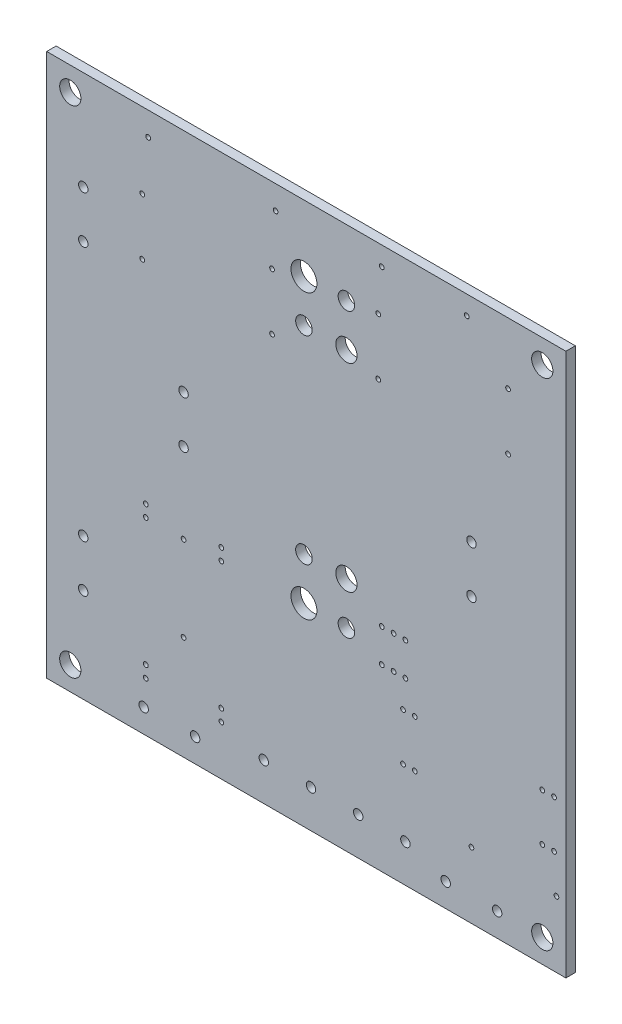
from build123d import *

# Parameters (mm, degrees)
SKETCH_1_W          = 110
SKETCH_1_H          = 115
SKETCH_1_R          = 2.25
EXTRUDE_1_DEPTH     = 2
SKETCH_2_R          = 1
SKETCH_2_R_2        = 0.5
CUT_EXTRUDE_1_DEPTH = 2
SKETCH_3_R          = 1
SKETCH_3_R_2        = 1.75
SKETCH_3_R_3        = 2.75
SKETCH_3_R_4        = 2.25
SKETCH_3_R_5        = 0.5
CUT_EXTRUDE_2_DEPTH = 2
SKETCH_4_R          = 0.5
CUT_EXTRUDE_3_DEPTH = 10


with BuildPart() as part:
    # Эскиз1 → Вытянуть1 (new body)
    with BuildSketch(Plane.XY):
        Rectangle(SKETCH_1_W, SKETCH_1_H)
        with Locations((-50, 52.5)):
            Circle(SKETCH_1_R, mode=Mode.SUBTRACT)
        with Locations(Location((50, 52.5, 0), (0, 0, 180))):
            Circle(SKETCH_1_R, mode=Mode.SUBTRACT)
        with Locations((50, -52.5)):
            Circle(SKETCH_1_R, mode=Mode.SUBTRACT)
        with Locations(Location((-50, -52.5, 0), (0, 0, 180))):
            Circle(SKETCH_1_R, mode=Mode.SUBTRACT)
    extrude(amount=EXTRUDE_1_DEPTH)

    # Эскиз2 → Вырез-Вытянуть1 (cut)
    with BuildSketch(Plane.XY.offset(2)):
        with Locations((-47.25, -37.5)):
            Circle(SKETCH_2_R)
        with Locations((-47.25, -27.5)):
            Circle(SKETCH_2_R)
        with Locations((-47.25, 26.5)):
            Circle(SKETCH_2_R)
        with Locations((-47.25, 36.5)):
            Circle(SKETCH_2_R)
        with Locations((29.55, -52.5)):
            Circle(SKETCH_2_R)
        with Locations((40.45, -52.5)):
            Circle(SKETCH_2_R)
        with Locations((-34.45, -52.5)):
            Circle(SKETCH_2_R)
        with Locations((-23.55, -52.5)):
            Circle(SKETCH_2_R)
        with Locations((-34, -44.5)):
            Circle(SKETCH_2_R_2)
        with Locations((-34, -17.5)):
            Circle(SKETCH_2_R_2)
        with Locations((-18, -44.5)):
            Circle(SKETCH_2_R_2)
        with Locations((-18, -17.5)):
            Circle(SKETCH_2_R_2)
        with Locations((-34, -47)):
            Circle(SKETCH_2_R_2)
        with Locations((-9, -49.5)):
            Circle(SKETCH_2_R)
        with Locations((1, -49.5)):
            Circle(SKETCH_2_R)
        with Locations((11, -49.5)):
            Circle(SKETCH_2_R)
        with Locations((21, -49.5)):
            Circle(SKETCH_2_R)
        with Locations((-34, -15)):
            Circle(SKETCH_2_R_2)
        with Locations((-18, -15)):
            Circle(SKETCH_2_R_2)
        with Locations((-18, -47)):
            Circle(SKETCH_2_R_2)
        with Locations((23, -35.5)):
            Circle(SKETCH_2_R_2)
        with Locations((50, -35.5)):
            Circle(SKETCH_2_R_2)
        with Locations((20.5, -35.5)):
            Circle(SKETCH_2_R_2)
        with Locations((52.5, -35.5)):
            Circle(SKETCH_2_R_2)
        with Locations((23, -25.5)):
            Circle(SKETCH_2_R_2)
        with Locations((50, -25.5)):
            Circle(SKETCH_2_R_2)
        with Locations((20.5, -25.5)):
            Circle(SKETCH_2_R_2)
        with Locations((52.5, -25.5)):
            Circle(SKETCH_2_R_2)
        with Locations((-33.5, 52.5)):
            Circle(SKETCH_2_R_2)
        with Locations((-6.5, 52.5)):
            Circle(SKETCH_2_R_2)
    extrude(amount=-CUT_EXTRUDE_1_DEPTH, mode=Mode.SUBTRACT)

    # Эскиз3 → Вырез-Вытянуть2 (cut)
    with BuildSketch(Plane.XY.offset(2)):
        with Locations((-26, 9.5)):
            Circle(SKETCH_3_R)
        with Locations((-26, -0.5)):
            Circle(SKETCH_3_R)
        with Locations((-0.5, 34.5)):
            Circle(SKETCH_3_R_2)
        with Locations((-0.5, 43.5)):
            Circle(SKETCH_3_R_3)
        with Locations((8.5, 43.5)):
            Circle(SKETCH_3_R_2)
        with Locations((8.5, 34.5)):
            Circle(SKETCH_3_R_4)
        with Locations(Location((8.5, -16.5, 0), (0, 0, 180))):
            Circle(SKETCH_3_R_2)
        with Locations(Location((8.5, -7.5, 0), (0, 0, 180))):
            Circle(SKETCH_3_R_4)
        with Locations(Location((-0.5, -16.5, 0), (0, 0, 180))):
            Circle(SKETCH_3_R_3)
        with Locations(Location((-0.5, -7.5, 0), (0, 0, 180))):
            Circle(SKETCH_3_R_2)
        with Locations((35, 12.5)):
            Circle(SKETCH_3_R)
        with Locations((35, 2.5)):
            Circle(SKETCH_3_R)
        with Locations((21, -19.5)):
            Circle(SKETCH_3_R_5)
        with Locations((18.5, -19.5)):
            Circle(SKETCH_3_R_5)
        with Locations((16, -19.5)):
            Circle(SKETCH_3_R_5)
        with Locations((21, -12.5)):
            Circle(SKETCH_3_R_5)
        with Locations((18.5, -12.5)):
            Circle(SKETCH_3_R_5)
        with Locations((16, -12.5)):
            Circle(SKETCH_3_R_5)
        with Locations((-26, -35.5)):
            Circle(SKETCH_3_R_5)
        with Locations((-26, -17.5)):
            Circle(SKETCH_3_R_5)
        with Locations((35, -43.5)):
            Circle(SKETCH_3_R_5)
        with Locations((53, -43.5)):
            Circle(SKETCH_3_R_5)
        with Locations((16, 53.5)):
            Circle(SKETCH_3_R_5)
        with Locations((34, 53.5)):
            Circle(SKETCH_3_R_5)
    extrude(amount=-CUT_EXTRUDE_2_DEPTH, mode=Mode.SUBTRACT)

    # Эскиз4 → Вырез-Вытянуть3 (cut)
    with BuildSketch(Plane.XY.offset(2)):
        with Locations((15.25, 32.5)):
            Circle(SKETCH_4_R)
        with Locations((42.75, 32.5)):
            Circle(SKETCH_4_R)
        with Locations((15.25, 44.5)):
            Circle(SKETCH_4_R)
        with Locations((42.75, 44.5)):
            Circle(SKETCH_4_R)
        with Locations((-34.75, 29.5)):
            Circle(SKETCH_4_R)
        with Locations((-7.25, 29.5)):
            Circle(SKETCH_4_R)
        with Locations((-34.75, 41.5)):
            Circle(SKETCH_4_R)
        with Locations((-7.25, 41.5)):
            Circle(SKETCH_4_R)
    extrude(amount=-CUT_EXTRUDE_3_DEPTH, mode=Mode.SUBTRACT)


solid = part.part
